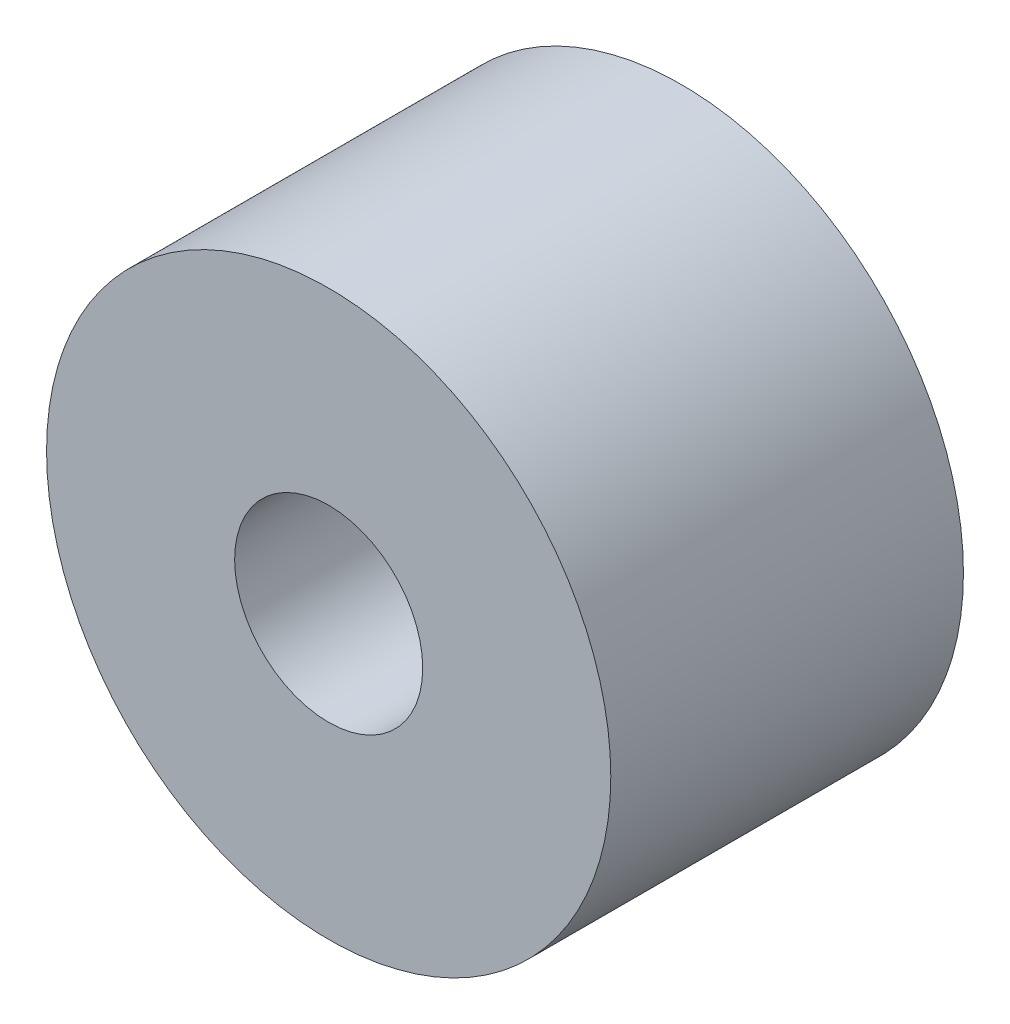
from build123d import *

# Parameters (mm, degrees)
SKETCH_1_R          = 12
EXTRUDE_1_DEPTH     = 15
SKETCH_2_R          = 4
CUT_EXTRUDE_1_DEPTH = 15


with BuildPart() as part:
    # 草图1 → 凸台-拉伸1 (new body)
    with BuildSketch(Plane.XY):
        Circle(SKETCH_1_R)
    extrude(amount=EXTRUDE_1_DEPTH)

    # 草图2 → 切除-拉伸1 (cut)
    with BuildSketch(Plane.XY):
        Circle(SKETCH_2_R)
    extrude(amount=CUT_EXTRUDE_1_DEPTH, mode=Mode.SUBTRACT)


solid = part.part
